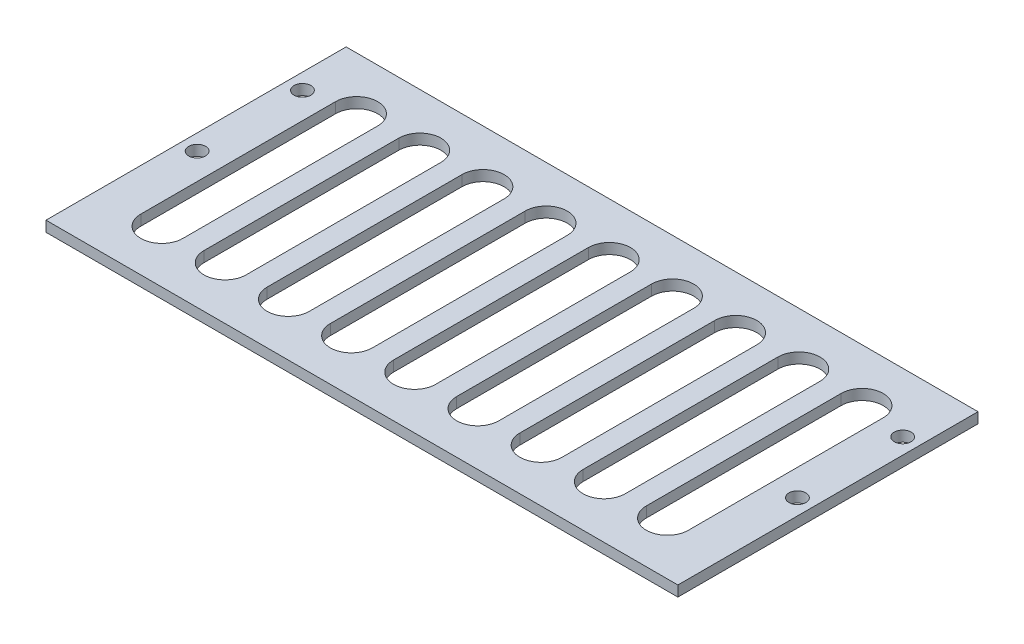
from build123d import *

# Parameters (mm, degrees)
SKETCH_1_W                 = 120
SKETCH_1_H                 = 57
EXTRUDE_1_DEPTH            = 2
SKETCH_2_R                 = 1.6
CUT_EXTRUDE_1_DEPTH        = 67.454871906
CUT_EXTRUDE_2_DEPTH        = 67.454871906
PATTERN_LINEAR_1_COUNT     = 5
PATTERN_LINEAR_1_PITCH     = 12
PATTERN_LINEAR_1_COL_COUNT = 5
PATTERN_LINEAR_1_COL_PITCH = 12


with BuildPart() as part:
    # 草图1 → 凸台-拉伸1 (new body)
    with BuildSketch(Plane(origin=(0, 0, 0), x_dir=(1, 0, 0), z_dir=(0, 1, 0))):
        Rectangle(SKETCH_1_W, SKETCH_1_H)
    extrude(amount=EXTRUDE_1_DEPTH)

    # 草图2 → 切除-拉伸1 (cut, through all)
    with BuildSketch(Plane(origin=(0, 2, 0), x_dir=(1, 0, 0), z_dir=(0, 1, 0))):
        with Locations(Location((-57, 17.2, 0), (0, 0, 270))):
            Circle(SKETCH_2_R)
        with Locations(Location((-57, -2.8, 0), (0, 0, 270))):
            Circle(SKETCH_2_R)
        with Locations(Location((57, -2.8, 0), (0, 0, 90))):
            Circle(SKETCH_2_R)
        with Locations(Location((57, 17.2, 0), (0, 0, 90))):
            Circle(SKETCH_2_R)
    extrude(amount=-CUT_EXTRUDE_1_DEPTH, mode=Mode.SUBTRACT)

    # 草图3 → 切除-拉伸2 (cut, through all)
    with BuildSketch(Plane(origin=(0, 2, 0), x_dir=(1, 0, 0), z_dir=(0, 1, 0))):
        with BuildLine():
            ThreePointArc((-4, -18.5), (0, -14.5), (4, -18.5))
            Line((4, -18.5), (4, 18.5))
            ThreePointArc((4, 18.5), (0, 14.5), (-4, 18.5))
            Line((-4, 18.5), (-4, -18.5))
        make_face()
        with BuildLine():
            ThreePointArc((-4, 18.5), (0, 14.5), (4, 18.5))
            Line((4, 18.5), (-4, 18.5))
        make_face()
        with BuildLine():
            Line((-4, 18.5), (4, 18.5))
            ThreePointArc((4, 18.5), (0, 22.5), (-4, 18.5))
        make_face()
        with BuildLine():
            ThreePointArc((-4, -18.5), (0, -22.5), (4, -18.5))
            Line((4, -18.5), (-4, -18.5))
        make_face()
        with BuildLine():
            Line((-4, -18.5), (4, -18.5))
            ThreePointArc((4, -18.5), (0, -14.5), (-4, -18.5))
        make_face()
    cut_extrude_2 = extrude(amount=-CUT_EXTRUDE_2_DEPTH, mode=Mode.SUBTRACT)

    # 阵列(线性)1: 切除-拉伸2 ×5
    with Locations(*[(i * PATTERN_LINEAR_1_PITCH, 0, 0) for i in range(1, PATTERN_LINEAR_1_COUNT)]):
        add(cut_extrude_2, mode=Mode.SUBTRACT)

    # 阵列(线性)1 col: 切除-拉伸2 ×5
    with Locations(*[(-i * PATTERN_LINEAR_1_COL_PITCH, 0, 0) for i in range(1, PATTERN_LINEAR_1_COL_COUNT)]):
        add(cut_extrude_2, mode=Mode.SUBTRACT)


solid = part.part
